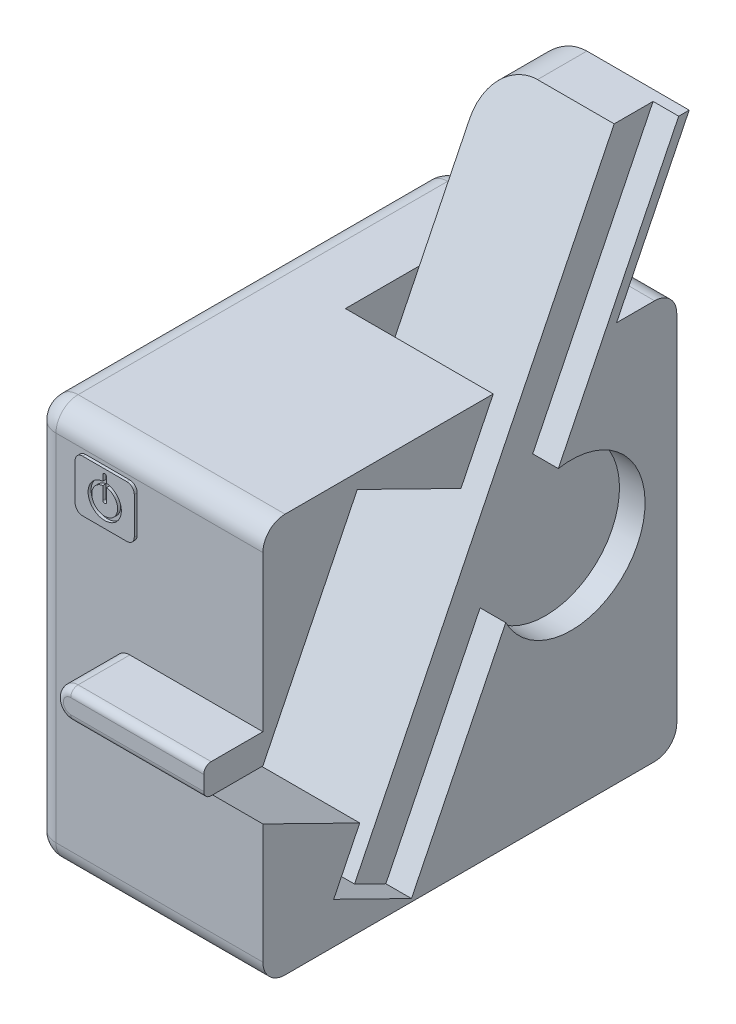
from build123d import *

# Parameters (mm, degrees)
SKETCH1_W           = 393.7
SKETCH1_H           = 342.9
BOSS_EXTRUDE1_DEPTH = 355.6
SKETCH2_W           = 50.8
SKETCH2_H           = 44.45
BOSS_EXTRUDE2_DEPTH = 2.54
BOSS_EXTRUDE3_DEPTH = 2.54
SKETCH4_R           = 3.81
CUT_EXTRUDE1_DEPTH  = 2.54
BOSS_EXTRUDE4_DEPTH = 50.8
FILLET1_R           = 6.35
FILLET2_R           = 6.35
SKETCH6_R           = 14.2875
SKETCH6_R_2         = 11.1125
CUT_EXTRUDE2_DEPTH  = 2.54
FILLET3_R           = 19.05
BOSS_EXTRUDE5_DEPTH = 127
FILLET4_R           = 39.116
SKETCH8_W           = 254
SKETCH8_H           = 63.5
CUT_EXTRUDE3_DEPTH  = 25.4
CUT_EXTRUDE4_DEPTH  = 652.703070808
CUT_EXTRUDE5_DEPTH  = 127
BOSS_EXTRUDE6_DEPTH = 127
SKETCH12_W          = 22
SKETCH12_H          = 524.644243645
CUT_EXTRUDE6_DEPTH  = 30
SKETCH13_R          = 63.5
CUT_EXTRUDE7_DEPTH  = 22


with BuildPart() as part:
    # Sketch1 → Boss-Extrude1 (new body)
    with BuildSketch(Plane.XY):
        with Locations((0, 171.45)):
            Rectangle(SKETCH1_W, SKETCH1_H)
    extrude(amount=BOSS_EXTRUDE1_DEPTH)

    # Sketch2 → Boss-Extrude2 (add)
    with BuildSketch(Plane.XY.offset(355.6)):
        with Locations((-133.35, 298.45)):
            Rectangle(SKETCH2_W, SKETCH2_H)
    extrude(amount=BOSS_EXTRUDE2_DEPTH)

    # Sketch3 → Boss-Extrude3 (add)
    with BuildSketch(Plane.XY.offset(355.6)):
        with BuildLine():
            Line((88.9, 307.975), (165.1, 307.975))
            ThreePointArc((165.1, 307.975), (174.625, 298.45), (165.1, 288.925))
            Line((165.1, 288.925), (88.9, 288.925))
            ThreePointArc((88.9, 288.925), (79.375, 298.45), (88.9, 307.975))
        make_face()
    extrude(amount=BOSS_EXTRUDE3_DEPTH)

    # Sketch4 → Cut-Extrude1 (cut)
    with BuildSketch(Plane.XY.offset(358.14)):
        with Locations((92.075, 298.45)):
            Circle(SKETCH4_R)
        with Locations((108.286467636, 298.45)):
            Circle(SKETCH4_R)
        with Locations((124.497935272, 298.45)):
            Circle(SKETCH4_R)
    extrude(amount=-CUT_EXTRUDE1_DEPTH, mode=Mode.SUBTRACT)

    # Sketch5 → Boss-Extrude4 (add)
    with BuildSketch(Plane.XY.offset(355.6)):
        with BuildLine():
            Line((-114.3, 190.5), (114.3, 190.5))
            ThreePointArc((114.3, 190.5), (127, 177.8), (114.3, 165.1))
            Line((114.3, 165.1), (-114.3, 165.1))
            ThreePointArc((-114.3, 165.1), (-127, 177.8), (-114.3, 190.5))
        make_face()
    extrude(amount=BOSS_EXTRUDE4_DEPTH)

    # Fillet1
    fillet1_edges = [part.edges().sort_by_distance(p)[0] for p in [
        (-127, 177.8, 406.4),
        (0, 165.1, 406.4),
        (127, 177.8, 406.4),
        (0, 190.5, 406.4),
    ]]
    fillet(fillet1_edges, radius=FILLET1_R)

    # Fillet2
    fillet2_edges = [part.edges().sort_by_distance(p)[0] for p in [
        (-107.95, 276.225, 356.87),
        (-107.95, 320.675, 356.87),
        (-158.75, 320.675, 356.87),
        (-158.75, 276.225, 356.87),
    ]]
    fillet(fillet2_edges, radius=FILLET2_R)

    # Sketch6 → Cut-Extrude2 (cut)
    # profile 1 of 2: a face of its own
    with BuildSketch(Plane.XY.offset(358.14)):
        with Locations((-133.35, 296.545)):
            Circle(SKETCH6_R)
        with Locations((-133.35, 296.545)):
            Circle(SKETCH6_R_2, mode=Mode.SUBTRACT)
    # profile 2 of 2: a face of its own
    with BuildSketch(Plane.XY.offset(358.14)):
        with BuildLine():
            Line((-134.9375, 296.545), (-134.9375, 315.595))
            ThreePointArc((-134.9375, 315.595), (-133.35, 317.1825), (-131.7625, 315.595))
            Line((-131.7625, 315.595), (-131.7625, 296.545))
            ThreePointArc((-131.7625, 296.545), (-133.35, 294.9575), (-134.9375, 296.545))
        make_face()
    extrude(amount=-CUT_EXTRUDE2_DEPTH, mode=Mode.SUBTRACT)

    # Fillet3
    fillet3_edges = [part.edges().sort_by_distance(p)[0] for p in [
        (196.85, 171.45, 355.6),
        (0, 342.9, 355.6),
        (-196.85, 171.45, 355.6),
        (0, 342.9, 0),
        (196.85, 171.45, 0),
        (0, 0, 0),
        (-196.85, 171.45, 0),
        (0, 0, 355.6),
        (-196.85, 342.9, 177.8),
        (196.85, 342.9, 177.8),
        (196.85, 0, 177.8),
        (-196.85, 0, 177.8),
    ]]
    fillet(fillet3_edges, radius=FILLET3_R)

    # Sketch7 → Boss-Extrude5 (add, symmetric)
    with BuildSketch(Plane(origin=(0, 0, 0), x_dir=(0, 0, -1), z_dir=(1, 0, 0))):
        Polygon((-51.727584486, 342.9), (10.662740116, 469.9), (-31.786520589, 469.9), (-94.17684519, 342.9), align=None)
    extrude(amount=BOSS_EXTRUDE5_DEPTH, both=True)

    # Fillet4
    fillet4_edges = [part.edges().sort_by_distance(p)[0] for p in [
        (-127, 469.9, 10.561890237),
        (127, 469.9, 10.561890237),
    ]]
    fillet(fillet4_edges, radius=FILLET4_R)

    # Sketch8 → Cut-Extrude3 (cut)
    with BuildSketch(Plane(origin=(0, 342.9, 0), x_dir=(1, 0, 0), z_dir=(0, 1, 0))):
        with Locations((0, -125.92684519)):
            Rectangle(SKETCH8_W, SKETCH8_H)
    extrude(amount=-CUT_EXTRUDE3_DEPTH, mode=Mode.SUBTRACT)

    # Sketch9 → Cut-Extrude4 (cut, through all)
    with BuildSketch(Plane(origin=(0, 0, 0), x_dir=(0, 0, -1), z_dir=(1, 0, 0))):
        Polygon((-912.709368589, 769.44705767), (-210.006014515, -1175.153028305), (1122.715383104, 405.705970635), align=None)
    extrude(amount=CUT_EXTRUDE4_DEPTH, mode=Mode.SUBTRACT)

    # Sketch10 → Cut-Extrude5 (cut)
    with BuildSketch(Plane(origin=(0, 0, 0), x_dir=(0, 0, -1), z_dir=(1, 0, 0))):
        Polygon((-94.17684519, 342.9), (-254.864319987, 15.809069962), (-294.760067802, 35.408350722), (-272.360889792, 81.003491082), (-355.6, 121.895736006), (-355.6, 165.1), (-274.492578018, 330.2), (-185.41399178, 286.439040076), (-157.67684519, 342.9), align=None)
    extrude(amount=-CUT_EXTRUDE5_DEPTH, mode=Mode.SUBTRACT)

    # Sketch11 → Boss-Extrude6 (add)
    with BuildSketch(Plane(origin=(0, 0, 0), x_dir=(0, 0, -1), z_dir=(1, 0, 0))):
        Polygon((-94.17684519, 342.9), (-106.65491011, 317.5), (-94.17684519, 317.5), align=None)
    extrude(amount=-BOSS_EXTRUDE6_DEPTH)

    # Sketch12 → Cut-Extrude6 (cut)
    with BuildSketch(Plane(origin=(0, 103.936656142, 211.570550632), x_dir=(1, 0, 0), z_dir=(0, 0.4409287009906531, 0.8975421330738157))):
        with Locations((-11, 164.134434658)):
            Rectangle(SKETCH12_W, SKETCH12_H)
    extrude(amount=-CUT_EXTRUDE6_DEPTH, mode=Mode.SUBTRACT)

    # Sketch13 → Cut-Extrude7 (cut)
    with BuildSketch(Plane(origin=(0, 0, 0), x_dir=(0, 0, -1), z_dir=(1, 0, 0))):
        with Locations((-90.736174491, 196.869487567)):
            Circle(SKETCH13_R)
    extrude(amount=-CUT_EXTRUDE7_DEPTH, mode=Mode.SUBTRACT)


solid = part.part
